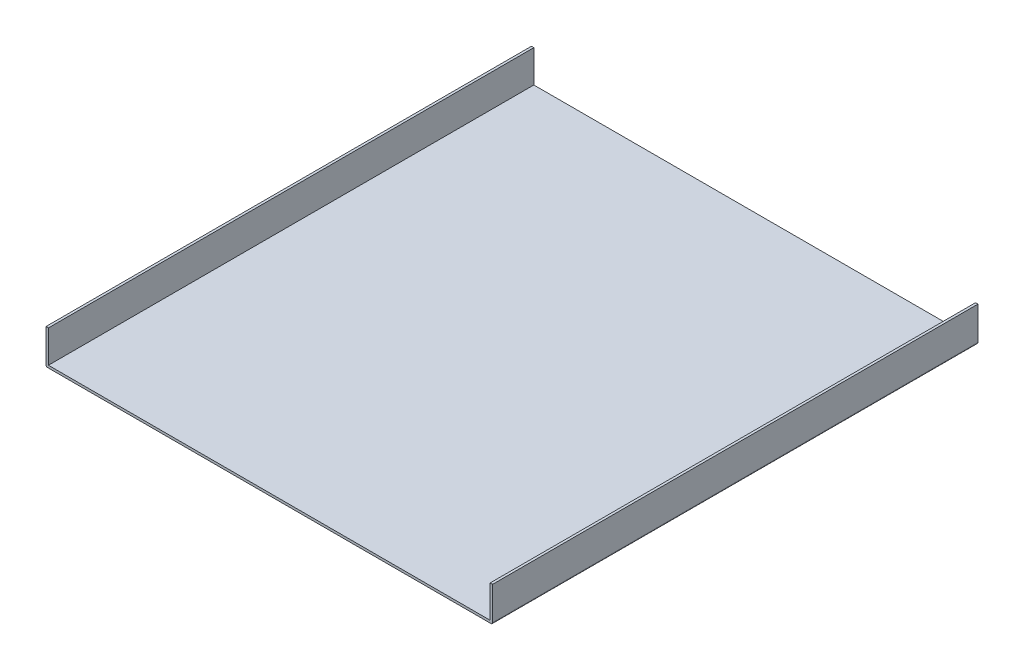
from build123d import *

# Parameters (mm, degrees)
SKETCH1_W           = 276
SKETCH1_H           = 300
BOSS_EXTRUDE1_DEPTH = 1.5
SKETCH2_W           = 1.5
SKETCH2_H           = 300
BOSS_EXTRUDE2_DEPTH = 20
FILLET1_R           = 1


with BuildPart() as part:
    # Sketch1 → Boss-Extrude1 (new body)
    with BuildSketch(Plane(origin=(0, 0, 0), x_dir=(1, 0, 0), z_dir=(0, 1, 0))):
        Rectangle(SKETCH1_W, SKETCH1_H)
    extrude(amount=BOSS_EXTRUDE1_DEPTH)

    # Sketch2 → Boss-Extrude2 (add)
    with BuildSketch(Plane(origin=(0, 1.5, 0), x_dir=(1, 0, 0), z_dir=(0, 1, 0))):
        with Locations((-137.25, 0)):
            Rectangle(SKETCH2_W, SKETCH2_H)
        with Locations((137.25, 0)):
            Rectangle(SKETCH2_W, SKETCH2_H)
    extrude(amount=BOSS_EXTRUDE2_DEPTH)

    # Fillet1
    fillet1_edges = [part.edges().sort_by_distance(p)[0] for p in [
        (-138, 0, 0),
        (138, 0, 0),
    ]]
    fillet(fillet1_edges, radius=FILLET1_R)


solid = part.part
